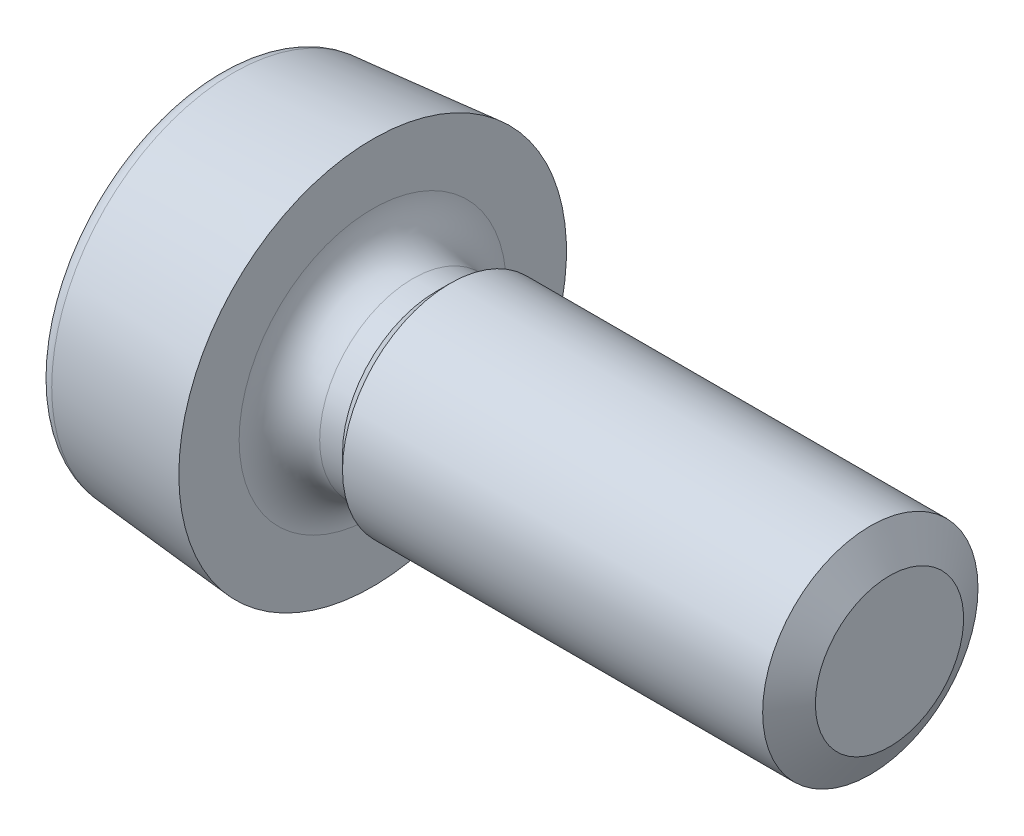
from build123d import *

# Parameters (mm, degrees)
PATTERN_CIRCULAR_1_COUNT = 2
PATTERN_CIRCULAR_1_ANGLE = 90


with BuildPart() as part:
    # 草图3 → Revolve 850 (revolve)
    with BuildSketch(Plane.XY, mode=Mode.PRIVATE) as revolve_850_sk:
        with BuildLine():
            Line((0, 0), (7.8, 0))
            Line((7.8, 0), (7.8, 1.25))
            Line((7.8, 1.25), (2.7, 1.25))
            Line((2.7, 1.25), (2.5325, 1.0825))
            Line((2.5325, 1.0825), (2.2675, 1.0825))
            ThreePointArc((2.2675, 1.0825), (1.93692758, 1.21942758), (1.8, 1.55))
            Line((1.8, 1.55), (1.8, 2.25))
            Line((1.8, 2.25), (0.182568851, 2.10849311))
            ThreePointArc((0.182568851, 2.10849311), (0.052544533, 2.044372212), (0, 1.909254171))
            Line((0, 1.909254171), (0, 0))
        make_face()
    revolve(revolve_850_sk.sketch.rotate(Axis((-2.16958059, 0, 0), (1, 0, 0)), 90), axis=Axis((-2.16958059, 0, 0), (1, 0, 0)))

    # 草图4 → 切除-旋转1 (revolve, cut)
    with BuildSketch(Plane.XY, mode=Mode.PRIVATE) as cut_revolve_1_sk:
        Polygon((7.577437203, 1.25), (8.027437203, 1.25), (7.8, 0.8603), align=None)
    revolve(cut_revolve_1_sk.sketch.rotate(Axis((-0.21798541, 0, 0), (1, 0, 0)), 90), axis=Axis((-0.21798541, 0, 0), (1, 0, 0)), mode=Mode.SUBTRACT)

    # 草图5 → 切除-放样1 section 0
    with BuildSketch(Plane.ZY, mode=Mode.PRIVATE) as loft_1_s0:
        with BuildLine():
            Line((-0.225, 1.35), (0.225, 1.35))
            Line((0.225, 1.35), (0.225, -1.35))
            Line((0.225, -1.35), (-0.225, -1.35))
            Line((-0.225, -1.35), (-0.225, 1.35))
        make_face()
    loft_1 = loft([loft_1_s0.sketch, Vertex(1.2, 0, 0)], mode=Mode.SUBTRACT)

    # 阵列(圆周)1: 切除-放样1 ×2 about axis
    pattern_circular_1_axis = Axis((0, 0, 0), (1, 0, 0))
    for i in range(1, PATTERN_CIRCULAR_1_COUNT):
        add(loft_1.rotate(pattern_circular_1_axis, i * PATTERN_CIRCULAR_1_ANGLE / (PATTERN_CIRCULAR_1_COUNT - 1)), mode=Mode.SUBTRACT)


solid = part.part
